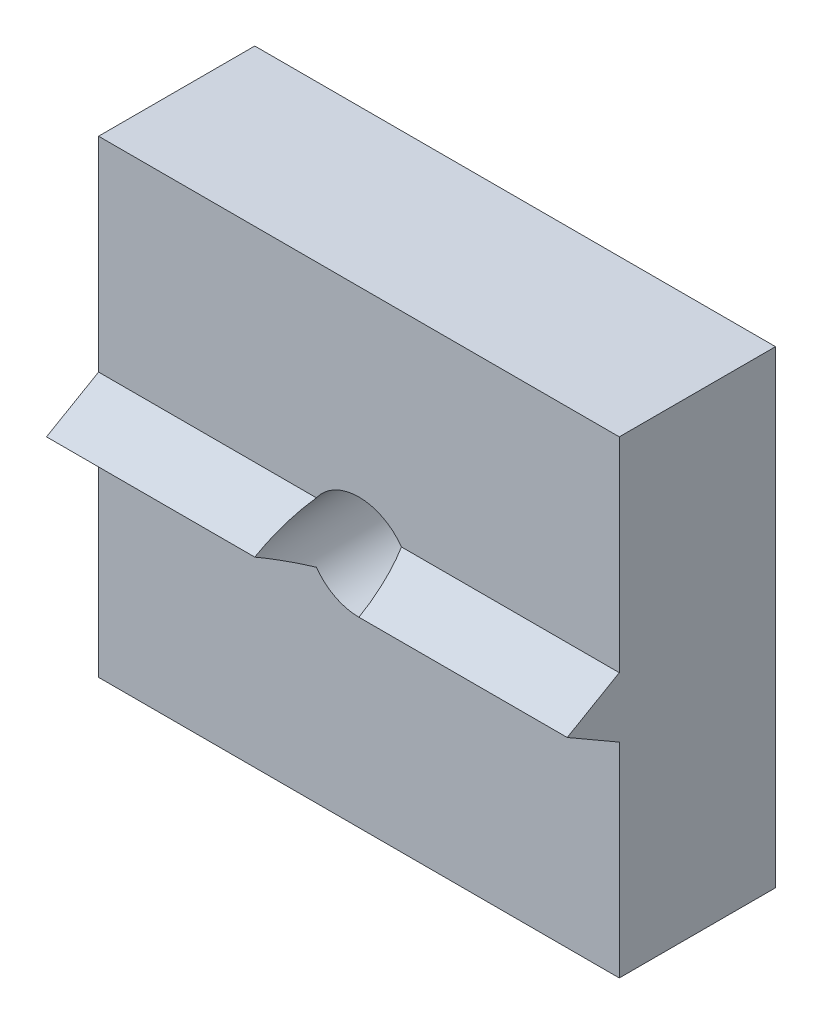
from build123d import *

# Parameters (mm, degrees)
SKETCH1_W           = 10
SKETCH1_H           = 9
BOSS_EXTRUDE1_DEPTH = 3
BOSS_EXTRUDE2_DEPTH = 10
CUT_EXTRUDE1_REACH  = 9.826
SKETCH3_R           = 1


with BuildPart() as part:
    # Sketch1 → Boss-Extrude1 (new body)
    with BuildSketch(Plane.XY):
        Rectangle(SKETCH1_W, SKETCH1_H)
    extrude(amount=BOSS_EXTRUDE1_DEPTH)

    # Sketch2 → Boss-Extrude2 (add)
    with BuildSketch(Plane(origin=(5, 0, 0), x_dir=(0, 0, -1), z_dir=(1, 0, 0))):
        Polygon((-4, 0), (-2.5, -0.866025404), (-2.5, 0.866025404), align=None)
    extrude(amount=-BOSS_EXTRUDE2_DEPTH)

    # Sketch3 → Cut-Extrude1 (cut, up to next)
    with BuildSketch(Plane(origin=(0, 0, 0), x_dir=(-1, 0, 0), z_dir=(0, 0, -1)), mode=Mode.PRIVATE) as cut_extrude1_sk1:
        Circle(SKETCH3_R)
    cut_extrude1_tool1 = extrude(cut_extrude1_sk1.sketch, amount=-CUT_EXTRUDE1_REACH, mode=Mode.PRIVATE) & part.part
    add(cut_extrude1_tool1.solids().sort_by_distance((0, 0, 0))[0], mode=Mode.SUBTRACT)


solid = part.part
